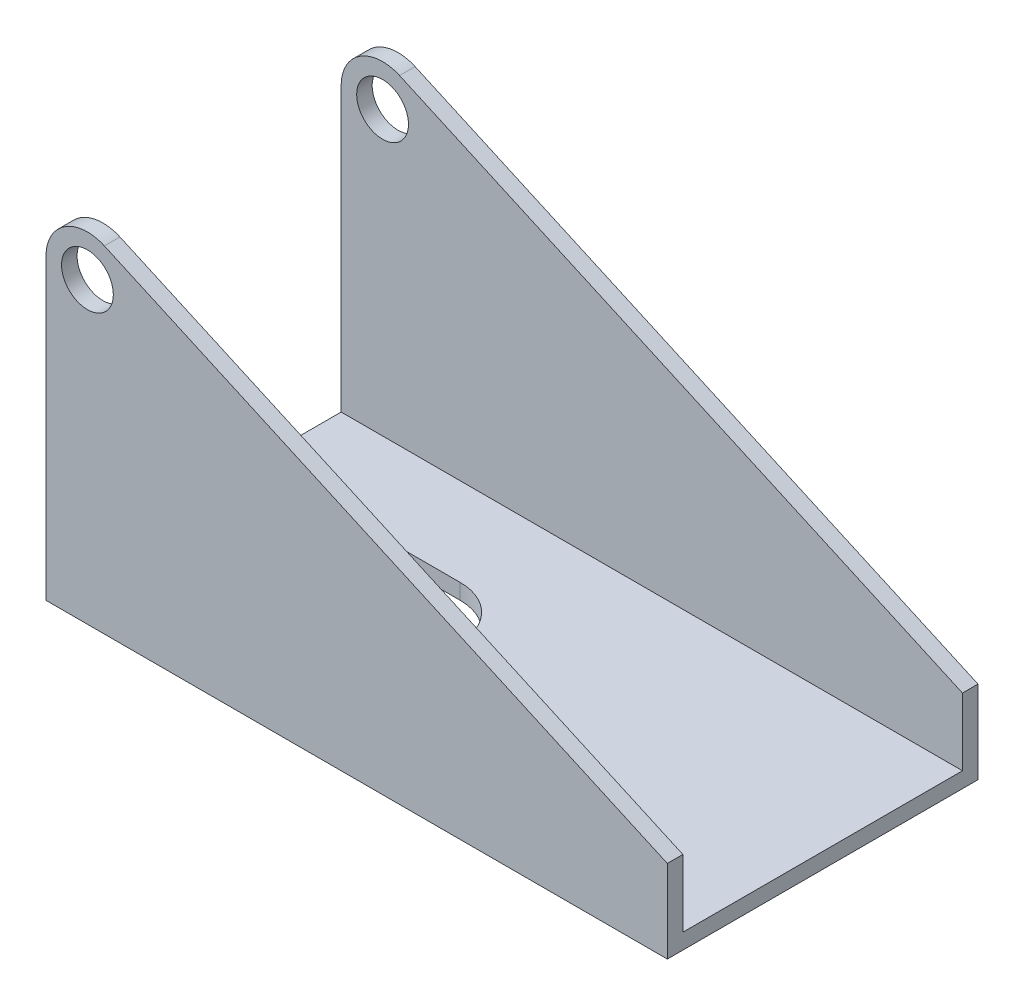
from build123d import *

# Parameters (mm, degrees)
SALIENTE_EXTRUIR1_DEPTH = 30
CROQUIS2_R              = 2.5
CORTAR_EXTRUIR1_DEPTH   = 71.10083252
CROQUIS3_W              = 27
CROQUIS3_H              = 62.627315121
CORTAR_EXTRUIR2_DEPTH   = 72
CORTAR_EXTRUIR3_DEPTH   = 64.283609709


with BuildPart() as part:
    # Croquis1 → Saliente-Extruir1 (new body)
    with BuildSketch(Plane.XY):
        with BuildLine():
            Line((-13.910195184, 10.658823529), (-13.910195184, 39.47248109))
            ThreePointArc((-13.910195184, 39.47248109), (-12.082079753, 42.831486511), (-8.268736475, 43.12016711))
            Line((-8.268736475, 43.12016711), (46.089804816, 18.658823529))
            Line((46.089804816, 18.658823529), (46.089804816, 10.658823529))
            Line((46.089804816, 10.658823529), (-13.910195184, 10.658823529))
        make_face()
    extrude(amount=SALIENTE_EXTRUIR1_DEPTH)

    # Croquis2 → Cortar-Extruir1 (cut, through all)
    with BuildSketch(Plane.XY.offset(30)):
        with Locations((-9.910195184, 39.47248109)):
            Circle(CROQUIS2_R)
    extrude(amount=-CORTAR_EXTRUIR1_DEPTH, mode=Mode.SUBTRACT)

    # Croquis3 → Cortar-Extruir2 (cut)
    with BuildSketch(Plane.ZY.offset(13.910195184)):
        with Locations((15, 43.47248109)):
            Rectangle(CROQUIS3_W, CROQUIS3_H)
    extrude(amount=-CORTAR_EXTRUIR2_DEPTH, mode=Mode.SUBTRACT)

    # Croquis4 → Cortar-Extruir3 (cut, through all)
    with BuildSketch(Plane(origin=(0, 12.158823529, 0), x_dir=(1, 0, 0), z_dir=(0, 1, 0))):
        with BuildLine():
            Line((-33.910195184, -20), (6.089804816, -20))
            ThreePointArc((6.089804816, -20), (11.089804816, -15), (6.089804816, -10))
            Line((6.089804816, -10), (-33.910195184, -10))
            Line((-33.910195184, -10), (-33.910195184, -20))
        make_face()
    extrude(amount=-CORTAR_EXTRUIR3_DEPTH, mode=Mode.SUBTRACT)


solid = part.part
